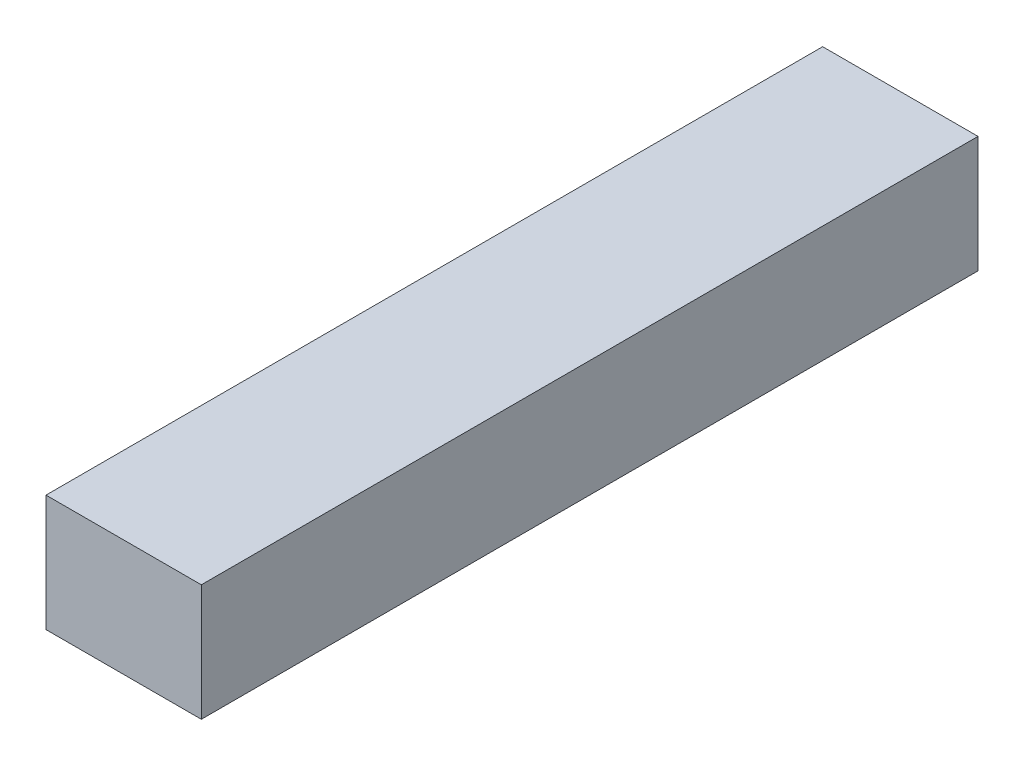
from build123d import *

# Parameters (mm, degrees)
SKETCH_1_W      = 20
SKETCH_1_H      = 100
EXTRUDE_1_DEPTH = 15


with BuildPart() as part:
    # 草图1 → 凸台-拉伸1 (new body)
    with BuildSketch(Plane(origin=(0, 0, 0), x_dir=(1, 0, 0), z_dir=(0, 1, 0))):
        with Locations((0, 50)):
            Rectangle(SKETCH_1_W, SKETCH_1_H)
    extrude(amount=EXTRUDE_1_DEPTH)


solid = part.part
